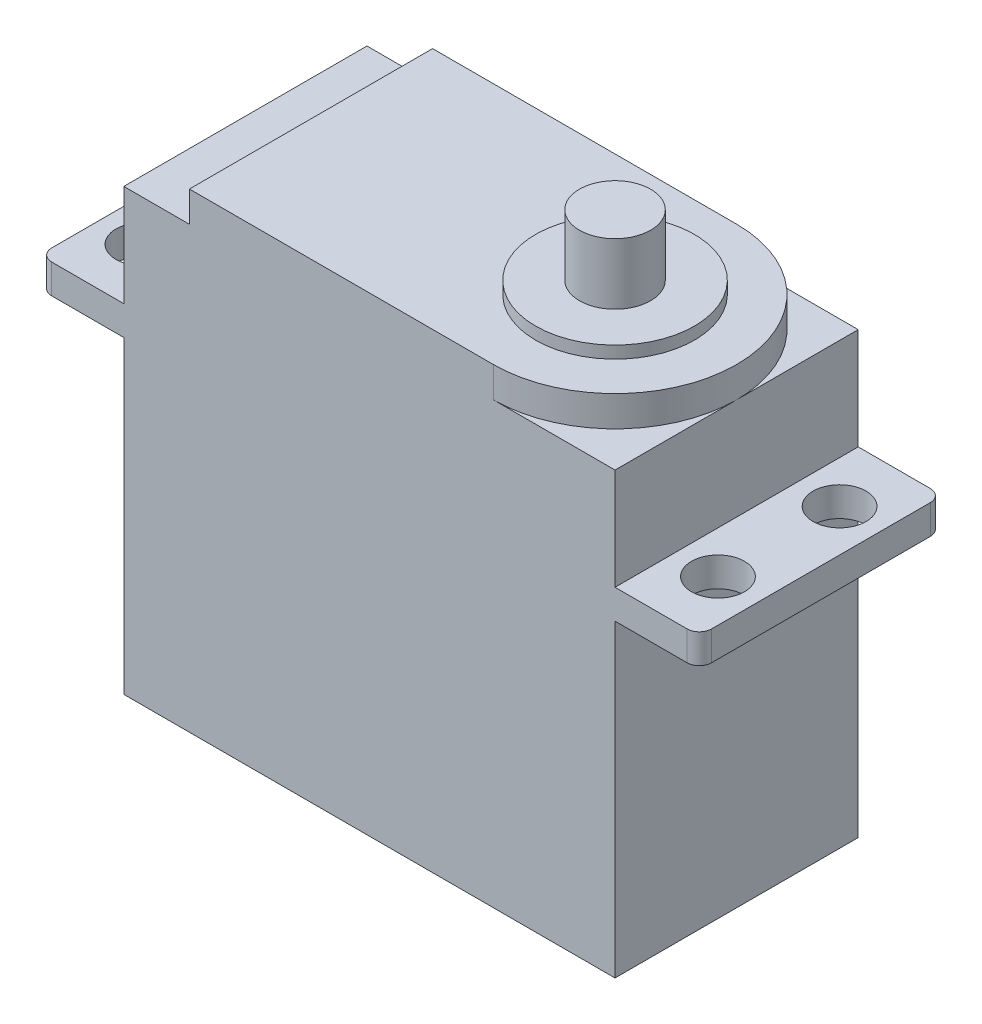
from build123d import *

# Parameters (mm, degrees)
CROQUIS1_W              = 40.2
CROQUIS1_H              = 19.9
SALIENTE_EXTRUIR1_DEPTH = 36
CROQUIS4_W              = 19.9
CROQUIS4_H              = 2.4
SALIENTE_EXTRUIR3_DEPTH = 27
CROQUIS5_R              = 2.165
CORTAR_EXTRUIR2_DEPTH   = 57.31
SALIENTE_EXTRUIR5_DEPTH = 2.5
SALIENTE_EXTRUIR6_DEPTH = 1
CROQUIS8_R              = 2.91
SALIENTE_EXTRUIR7_DEPTH = 5
REDONDEO1_R             = 1


with BuildPart() as part:
    # Croquis1 → Saliente-Extruir1 (new body)
    with BuildSketch(Plane(origin=(0, 0, 0), x_dir=(1, 0, 0), z_dir=(0, 1, 0))):
        Rectangle(CROQUIS1_W, CROQUIS1_H)
    extrude(amount=SALIENTE_EXTRUIR1_DEPTH)

    # Croquis4 → Saliente-Extruir3 (add, symmetric)
    with BuildSketch(Plane(origin=(0, 0, 0), x_dir=(0, 0, -1), z_dir=(1, 0, 0))):
        with Locations((0, 26.49)):
            Rectangle(CROQUIS4_W, CROQUIS4_H)
    extrude(amount=SALIENTE_EXTRUIR3_DEPTH, both=True)

    # Croquis5 → Cortar-Extruir2 (cut)
    with BuildSketch(Plane(origin=(0, 27.69, 0), x_dir=(1, 0, 0), z_dir=(0, 1, 0))):
        with Locations(Location((-23.55, 4.975, 0), (0, 0, 270))):
            Circle(CROQUIS5_R)
        with Locations(Location((-23.55, -4.975, 0), (0, 0, 270))):
            Circle(CROQUIS5_R)
        with Locations(Location((23.55, 4.975, 0), (0, 0, 270))):
            Circle(CROQUIS5_R)
        with Locations(Location((23.55, -4.975, 0), (0, 0, 270))):
            Circle(CROQUIS5_R)
    extrude(amount=-CORTAR_EXTRUIR2_DEPTH, mode=Mode.SUBTRACT)

    # Croquis6 → Saliente-Extruir5 (add)
    with BuildSketch(Plane(origin=(0, 36, 0), x_dir=(1, 0, 0), z_dir=(0, 1, 0))):
        with BuildLine():
            ThreePointArc((10.15, -9.95), (0.2, 0), (10.15, 9.95))
            Line((10.15, 9.95), (-14.73, 9.95))
            Line((-14.73, 9.95), (-14.73, -9.95))
            Line((-14.73, -9.95), (10.15, -9.95))
        make_face()
        with BuildLine():
            ThreePointArc((20.1, 0), (17.185712473, 7.035712473), (10.15, 9.95))
            Line((10.15, 9.95), (10.15, -9.95))
            ThreePointArc((10.15, -9.95), (17.185712473, -7.035712473), (20.1, 0))
        make_face()
        with BuildLine():
            Line((10.15, -9.95), (10.15, 9.95))
            ThreePointArc((10.15, 9.95), (0.2, 0), (10.15, -9.95))
        make_face()
    extrude(amount=SALIENTE_EXTRUIR5_DEPTH)

    # Croquis7 → Saliente-Extruir6 (add)
    with BuildSketch(Plane(origin=(0, 38.5, 0), x_dir=(1, 0, 0), z_dir=(0, 1, 0))):
        with BuildLine():
            ThreePointArc((10.15, 6.5), (3.65, 0), (10.15, -6.5))
            Line((10.15, -6.5), (10.15, 6.5))
        make_face()
        with BuildLine():
            Line((10.15, 6.5), (10.15, -6.5))
            ThreePointArc((10.15, -6.5), (14.746194078, -4.596194078), (16.65, 0))
            ThreePointArc((16.65, 0), (14.746194078, 4.596194078), (10.15, 6.5))
        make_face()
    extrude(amount=SALIENTE_EXTRUIR6_DEPTH)

    # Croquis8 → Saliente-Extruir7 (add)
    with BuildSketch(Plane(origin=(0, 39.5, 0), x_dir=(1, 0, 0), z_dir=(0, 1, 0))):
        with Locations(Location((10.15, 0, 0), (0, 0, 270))):
            Circle(CROQUIS8_R)
    extrude(amount=SALIENTE_EXTRUIR7_DEPTH)

    # Redondeo1
    redondeo1_edges = [part.edges().sort_by_distance(p)[0] for p in [
        (-27, 26.49, -9.95),
        (-27, 26.49, 9.95),
        (27, 26.49, -9.95),
        (27, 26.49, 9.95),
    ]]
    fillet(redondeo1_edges, radius=REDONDEO1_R)


solid = part.part
